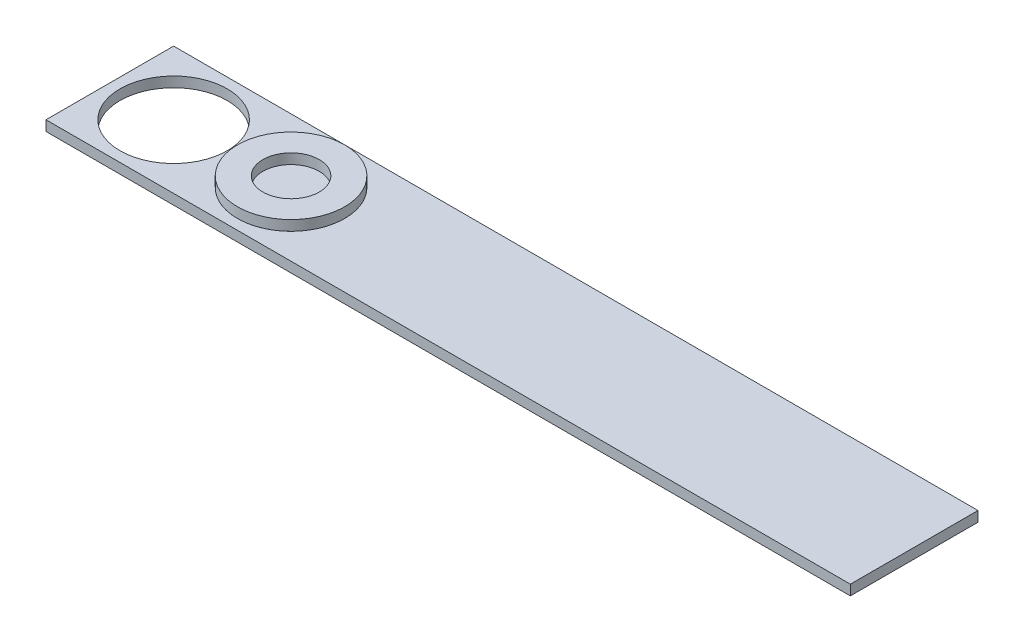
from build123d import *

# Parameters (mm, degrees)
SKETCH1_W           = 150
SKETCH1_H           = 23.8
BOSS_EXTRUDE1_DEPTH = 0.95
CUT_EXTRUDE2_REACH  = 77.962
SKETCH6_R           = 10
CUT_EXTRUDE1_REACH  = 77.962
SKETCH3_R           = 10
SKETCH4_R           = 10
SKETCH4_R_2         = 5.25
BOSS_EXTRUDE3_DEPTH = 0.95
SKETCH5_R           = 5.25
BOSS_EXTRUDE4_DEPTH = 0.95


with BuildPart() as part:
    # Sketch1 → Boss-Extrude1 (new, symmetric)
    with BuildSketch(Plane(origin=(0, 0, 0), x_dir=(1, 0, 0), z_dir=(0, 1, 0))):
        Rectangle(SKETCH1_W, SKETCH1_H)
    extrude(amount=BOSS_EXTRUDE1_DEPTH, both=True)

    # Sketch6 → Cut-Extrude2 (cut, up to next)
    with BuildSketch(Plane(origin=(0, 0.95, 0), x_dir=(1, 0, 0), z_dir=(0, 1, 0)), mode=Mode.PRIVATE) as cut_extrude2_sk1:
        with Locations(Location((-63.1, 0, 0), (0, 0, 270))):
            Circle(SKETCH6_R)
    cut_extrude2_tool1 = extrude(cut_extrude2_sk1.sketch, amount=-CUT_EXTRUDE2_REACH, mode=Mode.PRIVATE) & part.part
    add(cut_extrude2_tool1.solids().sort_by_distance((-63.1, 0.95, 0))[0], mode=Mode.SUBTRACT)

    # Sketch3 → Cut-Extrude1 (cut, up to next)
    with BuildSketch(Plane(origin=(0, 0.95, 0), x_dir=(1, 0, 0), z_dir=(0, 1, 0)), mode=Mode.PRIVATE) as cut_extrude1_sk1:
        with Locations(Location((-41.2, 0, 0), (0, 0, 270))):
            Circle(SKETCH3_R)
    cut_extrude1_tool1 = extrude(cut_extrude1_sk1.sketch, amount=-CUT_EXTRUDE1_REACH, mode=Mode.PRIVATE) & part.part
    add(cut_extrude1_tool1.solids().sort_by_distance((-41.2, 0.95, 0))[0], mode=Mode.SUBTRACT)


with BuildPart() as body_2:
    # Sketch4 → Boss-Extrude3 (new, symmetric)
    with BuildSketch(Plane(origin=(0, 1.9, 0), x_dir=(1, 0, 0), z_dir=(0, 1, 0))):
        with Locations(Location((-41.2, 0, 0), (0, 0, 90))):
            Circle(SKETCH4_R)
        with Locations(Location((-41.2, 0, 0), (0, 0, 90))):
            Circle(SKETCH4_R_2, mode=Mode.SUBTRACT)
    extrude(amount=BOSS_EXTRUDE3_DEPTH, both=True)


with BuildPart() as body_3:
    # Sketch5 → Boss-Extrude4 (new, symmetric)
    with BuildSketch(Plane(origin=(0, 0, 0), x_dir=(1, 0, 0), z_dir=(0, 1, 0))):
        with Locations(Location((-41.2, 0, 0), (0, 0, 90))):
            Circle(SKETCH5_R)
    extrude(amount=BOSS_EXTRUDE4_DEPTH, both=True)


solid = Compound([part.part, body_2.part, body_3.part])
